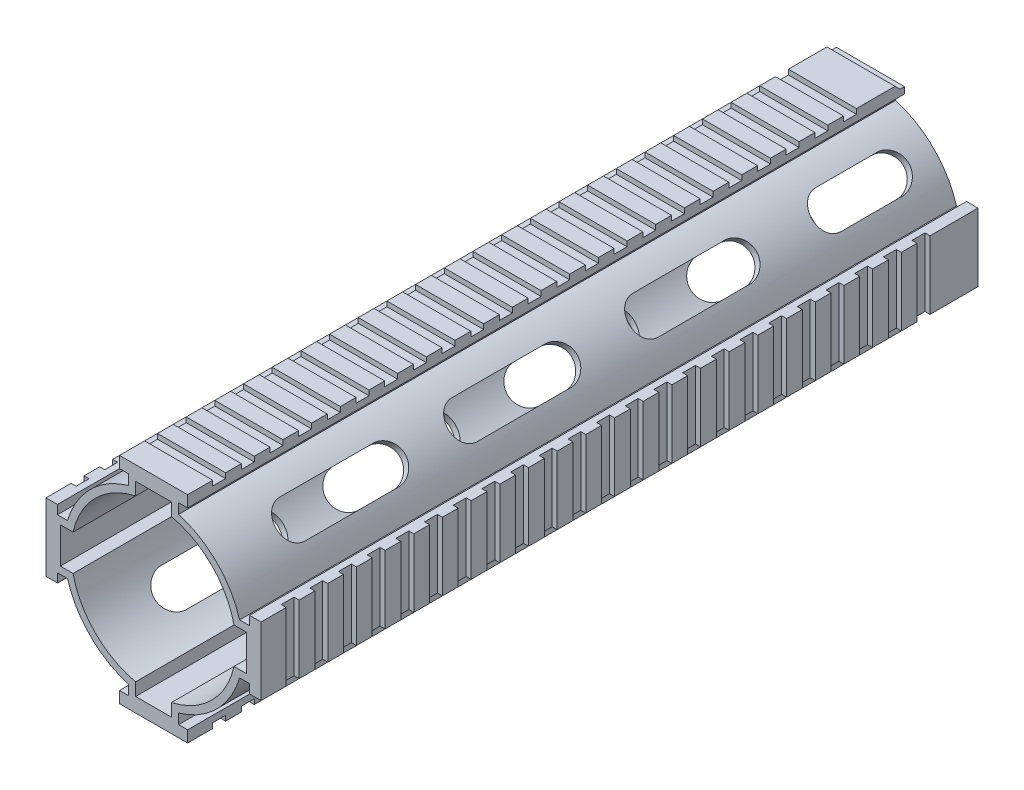
from build123d import *

# Parameters (mm, degrees)
EXTRUDE_1_DEPTH          = 200
CUT_EXTRUDE_1_DEPTH      = 210.341219976
SKETCH_4_W               = 3.6
SKETCH_4_H               = 1.4
CUT_EXTRUDE_2_DEPTH      = 205.4504831
CUT_EXTRUDE_3_DEPTH      = 205.4504831
CUT_EXTRUDE_3_DEPTH_BACK = 205.4504831
PATTERN_CIRCULAR_1_COUNT = 4


with BuildPart() as part:
    # 草图2 → 凸台-拉伸1 (new body)
    with BuildSketch(Plane.XY):
        with BuildLine():
            Line((-7, -24), (-7, -26.8))
            Line((-7, -26.8), (-9.5, -26.8))
            Line((-9.5, -26.8), (-9.5, -30))
            Line((-9.5, -30), (9.5, -30))
            Line((9.5, -30), (9.5, -26.8))
            Line((9.5, -26.8), (7, -26.8))
            Line((7, -26.8), (7, -24))
            ThreePointArc((7, -24), (17.67766953, -17.67766953), (24, -7))
            Line((24, -7), (26.8, -7))
            Line((26.8, -7), (26.8, -9.5))
            Line((26.8, -9.5), (30, -9.5))
            Line((30, -9.5), (30, 9.5))
            Line((30, 9.5), (26.8, 9.5))
            Line((26.8, 9.5), (26.8, 7))
            Line((26.8, 7), (24, 7))
            ThreePointArc((24, 7), (17.67766953, 17.67766953), (7, 24))
            Line((7, 24), (7, 26.8))
            Line((7, 26.8), (9.5, 26.8))
            Line((9.5, 26.8), (9.5, 30))
            Line((9.5, 30), (-9.5, 30))
            Line((-9.5, 30), (-9.5, 26.8))
            Line((-9.5, 26.8), (-7, 26.8))
            Line((-7, 26.8), (-7, 24))
            ThreePointArc((-7, 24), (-17.67766953, 17.67766953), (-24, 7))
            Line((-24, 7), (-26.8, 7))
            Line((-26.8, 7), (-26.8, 9.5))
            Line((-26.8, 9.5), (-30, 9.5))
            Line((-30, 9.5), (-30, -9.5))
            Line((-30, -9.5), (-26.8, -9.5))
            Line((-26.8, -9.5), (-26.8, -7))
            Line((-26.8, -7), (-24, -7))
            ThreePointArc((-24, -7), (-17.67766953, -17.67766953), (-7, -24))
        make_face()
        with BuildLine():
            Line((-22.449944321, 5), (-26, 5))
            Line((-26, 5), (-26, -5))
            Line((-26, -5), (-22.449944321, -5))
            ThreePointArc((-22.449944321, -5), (-16.263455967, -16.263455967), (-5, -22.449944321))
            Line((-5, -22.449944321), (-5, -26))
            Line((-5, -26), (5, -26))
            Line((5, -26), (5, -22.449944321))
            ThreePointArc((5, -22.449944321), (16.263455967, -16.263455967), (22.449944321, -5))
            Line((22.449944321, -5), (26, -5))
            Line((26, -5), (26, 5))
            Line((26, 5), (22.449944321, 5))
            ThreePointArc((22.449944321, 5), (16.263455967, 16.263455967), (5, 22.449944321))
            Line((5, 22.449944321), (5, 26))
            Line((5, 26), (-5, 26))
            Line((-5, 26), (-5, 22.449944321))
            ThreePointArc((-5, 22.449944321), (-16.263455967, 16.263455967), (-22.449944321, 5))
        make_face(mode=Mode.SUBTRACT)
    extrude(amount=-EXTRUDE_1_DEPTH)

    # 草图3 → 切除-拉伸1 (cut, through all)
    with BuildSketch(Plane(origin=(-13.72497216, 13.72497216, 0), x_dir=(-0.7071067811865475, -0.7071067811865477, 0), z_dir=(0.7071067811865477, -0.7071067811865475, 0))):
        with BuildLine():
            Line((-5, 21.5), (-5, 47.5))
            ThreePointArc((-5, 47.5), (0, 52.5), (5, 47.5))
            Line((5, 47.5), (5, 21.5))
            ThreePointArc((5, 21.5), (0, 16.5), (-5, 21.5))
        make_face()
        with BuildLine():
            Line((-5, 69.5), (-5, 95.5))
            ThreePointArc((-5, 95.5), (0, 100.5), (5, 95.5))
            Line((5, 95.5), (5, 69.5))
            ThreePointArc((5, 69.5), (0, 64.5), (-5, 69.5))
        make_face()
        with BuildLine():
            Line((-5, 120), (-5, 145.5))
            ThreePointArc((-5, 145.5), (0, 150.5), (5, 145.5))
            Line((5, 145.5), (5, 120))
            ThreePointArc((5, 120), (0, 115), (-5, 120))
        make_face()
        with BuildLine():
            Line((-5, 171), (-5, 188))
            ThreePointArc((-5, 188), (0, 193), (5, 188))
            Line((5, 188), (5, 171))
            ThreePointArc((5, 171), (0, 166), (-5, 171))
        make_face()
    cut_extrude_1 = extrude(amount=-CUT_EXTRUDE_1_DEPTH, mode=Mode.SUBTRACT)

    # 草图4 → 切除-拉伸2 (cut, symmetric)
    with BuildSketch(Plane(origin=(0, 0, 0), x_dir=(0, 0, -1), z_dir=(1, 0, 0))):
        with Locations((8.8, 29.3)):
            Rectangle(SKETCH_4_W, SKETCH_4_H)
        with Locations((16.8, 29.3)):
            Rectangle(SKETCH_4_W, SKETCH_4_H)
        with Locations((24.8, 29.3)):
            Rectangle(SKETCH_4_W, SKETCH_4_H)
        with Locations((32.8, 29.3)):
            Rectangle(SKETCH_4_W, SKETCH_4_H)
        with Locations((40.8, 29.3)):
            Rectangle(SKETCH_4_W, SKETCH_4_H)
        with Locations((48.8, 29.3)):
            Rectangle(SKETCH_4_W, SKETCH_4_H)
        with Locations((56.8, 29.3)):
            Rectangle(SKETCH_4_W, SKETCH_4_H)
        with Locations((64.8, 29.3)):
            Rectangle(SKETCH_4_W, SKETCH_4_H)
        with Locations((72.8, 29.3)):
            Rectangle(SKETCH_4_W, SKETCH_4_H)
        with Locations((80.8, 29.3)):
            Rectangle(SKETCH_4_W, SKETCH_4_H)
        with Locations((88.8, 29.3)):
            Rectangle(SKETCH_4_W, SKETCH_4_H)
        with Locations((96.8, 29.3)):
            Rectangle(SKETCH_4_W, SKETCH_4_H)
        with Locations((104.8, 29.3)):
            Rectangle(SKETCH_4_W, SKETCH_4_H)
        with Locations((112.8, 29.3)):
            Rectangle(SKETCH_4_W, SKETCH_4_H)
        with Locations((120.8, 29.3)):
            Rectangle(SKETCH_4_W, SKETCH_4_H)
        with Locations((128.8, 29.3)):
            Rectangle(SKETCH_4_W, SKETCH_4_H)
        with Locations((136.8, 29.3)):
            Rectangle(SKETCH_4_W, SKETCH_4_H)
        with Locations((144.8, 29.3)):
            Rectangle(SKETCH_4_W, SKETCH_4_H)
        with Locations((152.8, 29.3)):
            Rectangle(SKETCH_4_W, SKETCH_4_H)
        with Locations((160.8, 29.3)):
            Rectangle(SKETCH_4_W, SKETCH_4_H)
        with Locations((168.8, 29.3)):
            Rectangle(SKETCH_4_W, SKETCH_4_H)
        with Locations((176.8, 29.3)):
            Rectangle(SKETCH_4_W, SKETCH_4_H)
        with Locations((184.8, 29.3)):
            Rectangle(SKETCH_4_W, SKETCH_4_H)
    cut_extrude_2 = extrude(amount=CUT_EXTRUDE_2_DEPTH, both=True, mode=Mode.SUBTRACT)

    # 草图5 → 切除-拉伸3 (cut, two sides: drawn at the far end of the back side and taken through both)
    with BuildSketch(Plane(origin=(0, 0, 0), x_dir=(0, 0, -1), z_dir=(1, 0, 0)).offset(-CUT_EXTRUDE_3_DEPTH_BACK)):
        Polygon((200, 28.6), (198.75, 28.6), (197.35, 30), (200, 30), align=None)
    extrude(amount=CUT_EXTRUDE_3_DEPTH + CUT_EXTRUDE_3_DEPTH_BACK, mode=Mode.SUBTRACT)

    # 阵列(圆周)1: 切除-拉伸1, 切除-拉伸2 ×4 about axis
    pattern_circular_1_axis = Axis((0, 0, 0), (0, 0, 1))
    add([cut_extrude_1.rotate(pattern_circular_1_axis, i * 360 / PATTERN_CIRCULAR_1_COUNT) for i in range(1, PATTERN_CIRCULAR_1_COUNT)], mode=Mode.SUBTRACT)
    add([cut_extrude_2.rotate(pattern_circular_1_axis, i * 360 / PATTERN_CIRCULAR_1_COUNT) for i in range(1, PATTERN_CIRCULAR_1_COUNT)], mode=Mode.SUBTRACT)


solid = part.part
